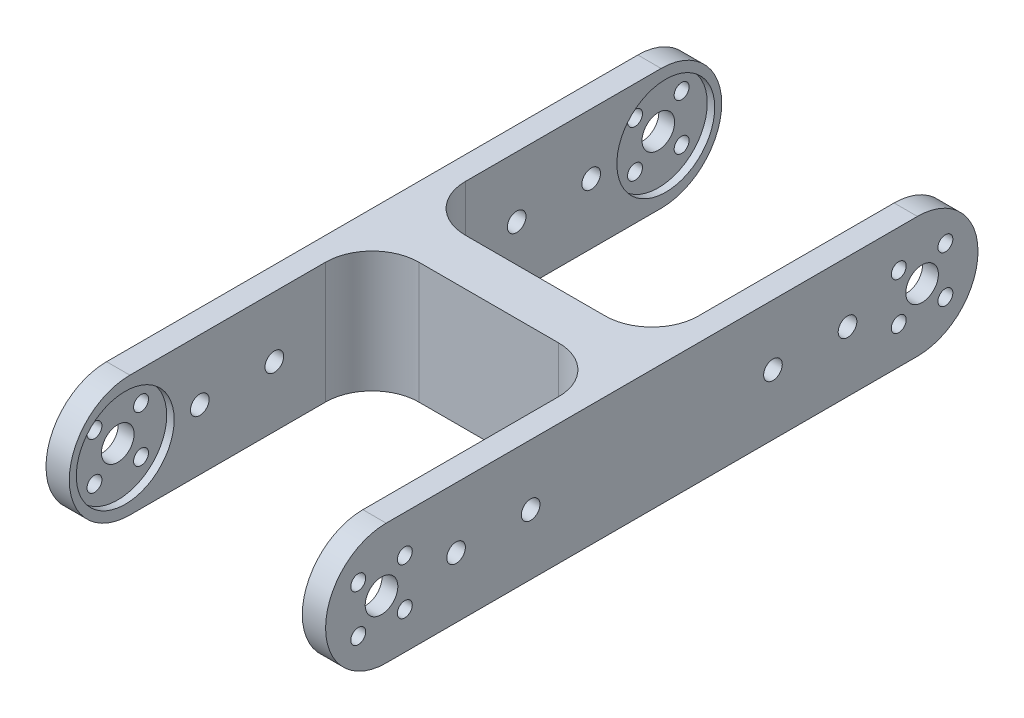
from build123d import *

# Parameters (mm, degrees)
EXTRUDE_1_DEPTH     = 26
SKETCH_2_R          = 3.5
SKETCH_2_R_2        = 1.6
SKETCH_2_R_3        = 2
CUT_EXTRUDE_2_DEPTH = 155.518607294
CUT_EXTRUDE_5_DEPTH = 155.518607294
SKETCH_5_R          = 10.5
CUT_EXTRUDE_6_DEPTH = 1.6
CUT_EXTRUDE_START   = -1.6
SKETCH_6_R          = 10.5
CUT_EXTRUDE_7_DEPTH = 1.6
SKETCH_7_R          = 10.5
CUT_EXTRUDE_8_DEPTH = 1.6
SKETCH_8_R          = 10.5
CUT_EXTRUDE_9_DEPTH = 1.6


with BuildPart() as part:
    # 草图1 → 凸台-拉伸1 (new body)
    with BuildSketch(Plane(origin=(0, 0, 0), x_dir=(1, 0, 0), z_dir=(0, 1, 0))):
        with BuildLine():
            Line((0, 0), (0, 140))
            Line((0, 140), (5, 140))
            Line((5, 140), (5, 85))
            ThreePointArc((5, 85), (7.928932188, 77.928932188), (15, 75))
            Line((15, 75), (45, 75))
            ThreePointArc((45, 75), (52.071067812, 77.928932188), (55, 85))
            Line((55, 85), (55, 140))
            Line((55, 140), (60, 140))
            Line((60, 140), (60, 0))
            Line((60, 0), (55, 0))
            Line((55, 0), (55, 55))
            ThreePointArc((55, 55), (52.071067812, 62.071067812), (45, 65))
            Line((45, 65), (15, 65))
            ThreePointArc((15, 65), (7.928932188, 62.071067812), (5, 55))
            Line((5, 55), (5, 0))
            Line((5, 0), (0, 0))
        make_face()
    extrude(amount=EXTRUDE_1_DEPTH)

    # 草图2 → 切除-拉伸2 (cut, through all)
    with BuildSketch(Plane(origin=(60, 0, 0), x_dir=(0, 0, -1), z_dir=(1, 0, 0))):
        with Locations((128, 13)):
            Circle(SKETCH_2_R)
        with Locations((123, 18)):
            Circle(SKETCH_2_R_2)
        with Locations((133, 18)):
            Circle(SKETCH_2_R_2)
        with Locations((133, 8)):
            Circle(SKETCH_2_R_2)
        with Locations((123, 8)):
            Circle(SKETCH_2_R_2)
        with Locations((12, 13)):
            Circle(SKETCH_2_R)
        with Locations((7, 18)):
            Circle(SKETCH_2_R_2)
        with Locations((7, 8)):
            Circle(SKETCH_2_R_2)
        with Locations((17, 8)):
            Circle(SKETCH_2_R_2)
        with Locations((17, 18)):
            Circle(SKETCH_2_R_2)
        with Locations((28, 13)):
            Circle(SKETCH_2_R_3)
        with Locations((44, 13)):
            Circle(SKETCH_2_R_3)
        with Locations(Location((96, 13, 0), (0, 0, 180))):
            Circle(SKETCH_2_R_3)
        with Locations(Location((112, 13, 0), (0, 0, 180))):
            Circle(SKETCH_2_R_3)
    extrude(amount=-CUT_EXTRUDE_2_DEPTH, mode=Mode.SUBTRACT)

    # 草图3 → 切除-拉伸5 (cut, through all)
    with BuildSketch(Plane.ZY):
        with BuildLine():
            Line((-127, 26), (-140, 26))
            Line((-140, 26), (-140, 13))
            ThreePointArc((-140, 13), (-136.192388155, 22.192388155), (-127, 26))
        make_face()
        with BuildLine():
            ThreePointArc((-127, 0), (-136.192388155, 3.807611845), (-140, 13))
            Line((-140, 13), (-140, 0))
            Line((-140, 0), (-127, 0))
        make_face()
        with BuildLine():
            ThreePointArc((0, 13), (-3.807611845, 3.807611845), (-13, 0))
            Line((-13, 0), (0, 0))
            Line((0, 0), (0, 13))
        make_face()
        with BuildLine():
            Line((0, 26), (-13, 26))
            ThreePointArc((-13, 26), (-3.807611845, 22.192388155), (0, 13))
            Line((0, 13), (0, 26))
        make_face()
    extrude(amount=-CUT_EXTRUDE_5_DEPTH, mode=Mode.SUBTRACT)

    # 草图5 → 切除-拉伸6 (cut)
    with BuildSketch(Plane.ZY.offset(-55)):
        with Locations((-128, 13)):
            Circle(SKETCH_5_R)
    extrude(amount=-CUT_EXTRUDE_6_DEPTH, mode=Mode.SUBTRACT)

    # 草图6 → 切除-拉伸7 (cut)
    with BuildSketch(Plane(origin=(5, 0, 0), x_dir=(0, 0, -1), z_dir=(1, 0, 0)).offset(CUT_EXTRUDE_START)):
        with Locations(Location((128, 13, 0), (0, 0, 180))):
            Circle(SKETCH_6_R)
    extrude(amount=CUT_EXTRUDE_7_DEPTH, mode=Mode.SUBTRACT)

    # 草图7 → 切除-拉伸8 (cut)
    with BuildSketch(Plane.ZY.offset(-55)):
        with Locations((-12, 13)):
            Circle(SKETCH_7_R)
    extrude(amount=-CUT_EXTRUDE_8_DEPTH, mode=Mode.SUBTRACT)

    # 草图8 → 切除-拉伸9 (cut)
    with BuildSketch(Plane(origin=(5, 0, 0), x_dir=(0, 0, -1), z_dir=(1, 0, 0)).offset(CUT_EXTRUDE_START)):
        with Locations(Location((12, 13, 0), (0, 0, 180))):
            Circle(SKETCH_8_R)
    extrude(amount=CUT_EXTRUDE_9_DEPTH, mode=Mode.SUBTRACT)


solid = part.part
